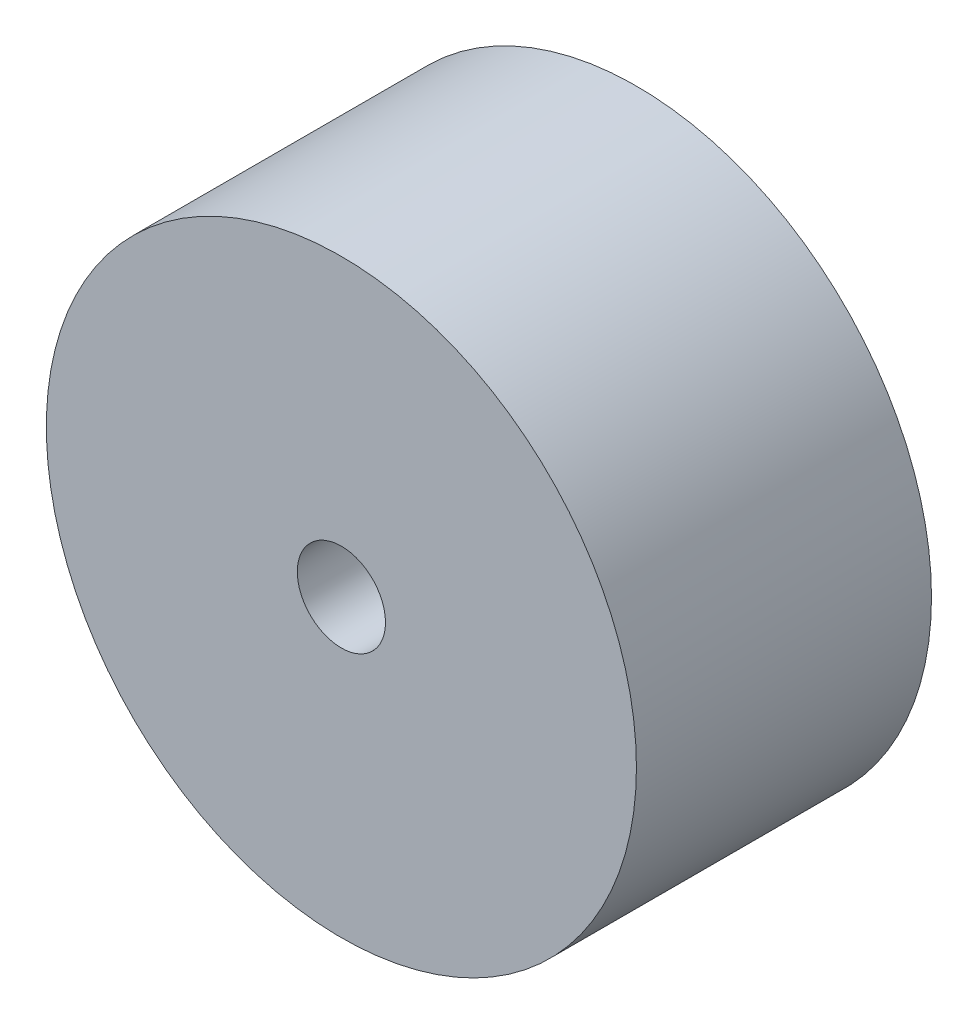
from build123d import *

# Parameters (mm, degrees)
SKETCH1_R             = 12.7
BOSS_EXTRUDE1_DEPTH   = 12.7
F_6_CLEARANCE_HOLE1_D = 3.7973


with BuildPart() as part:
    # Sketch1 → Boss-Extrude1 (new body)
    with BuildSketch(Plane.XY):
        Circle(SKETCH1_R)
    extrude(amount=BOSS_EXTRUDE1_DEPTH)

    # #6 Clearance Hole1 (through all)
    with Locations(Plane.XY.offset(12.7)):
        with Locations((0, 0)):
            Hole(F_6_CLEARANCE_HOLE1_D / 2)


solid = part.part
